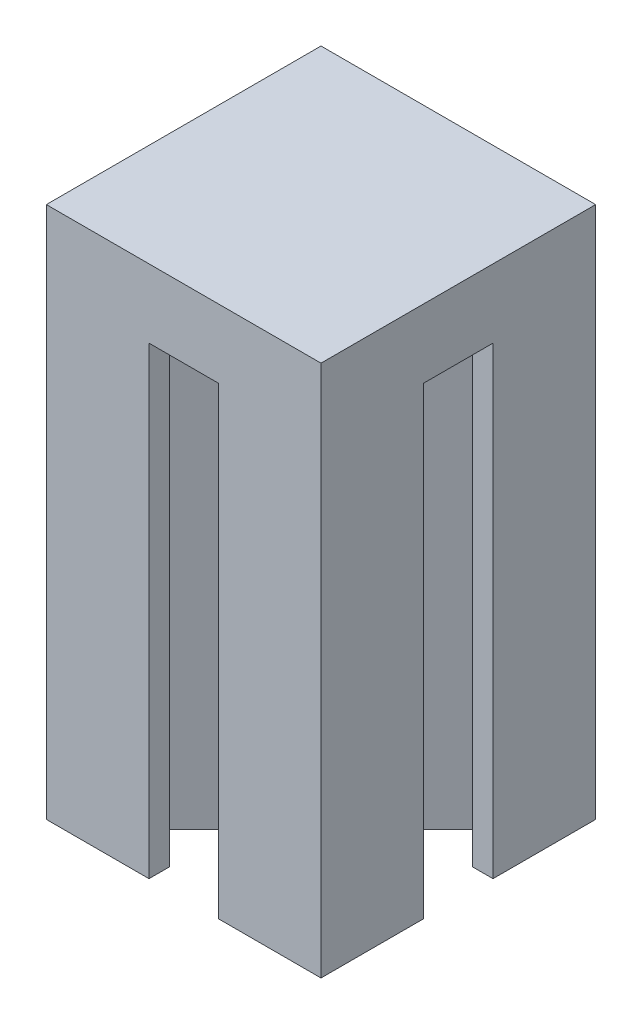
from build123d import *

# Parameters (mm, degrees)
BOSS_EXTRUDE1_DEPTH = 67.55
SKETCH2_W           = 40
SKETCH2_H           = 40
BOSS_EXTRUDE2_DEPTH = 10


with BuildPart() as part:
    # Sketch1 → Boss-Extrude1 (new body)
    with BuildSketch(Plane(origin=(0, 75.994571645, 0), x_dir=(1, 0, 0), z_dir=(0, 1, 0))):
        with BuildLine():
            Line((-75.17747299, -15.039868045), (-60.22747299, -15.039868045))
            Line((-60.22747299, -15.039868045), (-60.22747299, -12.039868045))
            Line((-60.22747299, -12.039868045), (-65.17747299, -12.039868045))
            Line((-65.17747299, -12.039868045), (-65.17747299, -12.539868045))
            Line((-65.17747299, -12.539868045), (-67.763259428, -12.539868045))
            ThreePointArc((-67.763259428, -12.539868045), (-68.68713896, -11.922551477), (-68.470366209, -10.832761264))
            Line((-68.470366209, -10.832761264), (-60.67747299, -3.039868045))
            Line((-60.67747299, -3.039868045), (-49.67747299, -3.039868045))
            Line((-49.67747299, -3.039868045), (-41.884579771, -10.832761264))
            ThreePointArc((-41.884579771, -10.832761264), (-41.66780702, -11.922551477), (-42.591686553, -12.539868045))
            Line((-42.591686553, -12.539868045), (-45.17747299, -12.539868045))
            Line((-45.17747299, -12.539868045), (-45.17747299, -12.039868045))
            Line((-45.17747299, -12.039868045), (-50.12747299, -12.039868045))
            Line((-50.12747299, -12.039868045), (-50.12747299, -15.039868045))
            Line((-50.12747299, -15.039868045), (-35.17747299, -15.039868045))
            Line((-35.17747299, -15.039868045), (-35.17747299, -0.089868045))
            Line((-35.17747299, -0.089868045), (-38.17747299, -0.089868045))
            Line((-38.17747299, -0.089868045), (-38.17747299, -5.039868045))
            Line((-38.17747299, -5.039868045), (-37.67747299, -5.039868045))
            Line((-37.67747299, -5.039868045), (-37.67747299, -7.625654482))
            ThreePointArc((-37.67747299, -7.625654482), (-38.294789558, -8.549534015), (-39.384579771, -8.332761264))
            Line((-39.384579771, -8.332761264), (-47.17747299, -0.539868045))
            Line((-47.17747299, -0.539868045), (-47.17747299, 10.460131955))
            Line((-47.17747299, 10.460131955), (-39.384579771, 18.253025174))
            ThreePointArc((-39.384579771, 18.253025174), (-38.294789558, 18.469797925), (-37.67747299, 17.545918393))
            Line((-37.67747299, 17.545918393), (-37.67747299, 14.960131955))
            Line((-37.67747299, 14.960131955), (-38.17747299, 14.960131955))
            Line((-38.17747299, 14.960131955), (-38.17747299, 10.010131955))
            Line((-38.17747299, 10.010131955), (-35.17747299, 10.010131955))
            Line((-35.17747299, 10.010131955), (-35.17747299, 24.960131955))
            Line((-35.17747299, 24.960131955), (-50.12747299, 24.960131955))
            Line((-50.12747299, 24.960131955), (-50.12747299, 21.960131955))
            Line((-50.12747299, 21.960131955), (-45.17747299, 21.960131955))
            Line((-45.17747299, 21.960131955), (-45.17747299, 22.460131955))
            Line((-45.17747299, 22.460131955), (-42.591686553, 22.460131955))
            ThreePointArc((-42.591686553, 22.460131955), (-41.66780702, 21.842815388), (-41.884579771, 20.753025174))
            Line((-41.884579771, 20.753025174), (-49.67747299, 12.960131955))
            Line((-49.67747299, 12.960131955), (-60.67747299, 12.960131955))
            Line((-60.67747299, 12.960131955), (-68.470366209, 20.753025174))
            ThreePointArc((-68.470366209, 20.753025174), (-68.68713896, 21.842815388), (-67.763259428, 22.460131955))
            Line((-67.763259428, 22.460131955), (-65.17747299, 22.460131955))
            Line((-65.17747299, 22.460131955), (-65.17747299, 21.960131955))
            Line((-65.17747299, 21.960131955), (-60.22747299, 21.960131955))
            Line((-60.22747299, 21.960131955), (-60.22747299, 24.960131955))
            Line((-60.22747299, 24.960131955), (-75.17747299, 24.960131955))
            Line((-75.17747299, 24.960131955), (-75.17747299, 10.010131955))
            Line((-75.17747299, 10.010131955), (-72.17747299, 10.010131955))
            Line((-72.17747299, 10.010131955), (-72.17747299, 14.960131955))
            Line((-72.17747299, 14.960131955), (-72.67747299, 14.960131955))
            Line((-72.67747299, 14.960131955), (-72.67747299, 17.545918393))
            ThreePointArc((-72.67747299, 17.545918393), (-72.060156423, 18.469797925), (-70.970366209, 18.253025174))
            Line((-70.970366209, 18.253025174), (-63.17747299, 10.460131955))
            Line((-63.17747299, 10.460131955), (-63.17747299, -0.539868045))
            Line((-63.17747299, -0.539868045), (-70.970366209, -8.332761264))
            ThreePointArc((-70.970366209, -8.332761264), (-72.060156423, -8.549534015), (-72.67747299, -7.625654482))
            Line((-72.67747299, -7.625654482), (-72.67747299, -5.039868045))
            Line((-72.67747299, -5.039868045), (-72.17747299, -5.039868045))
            Line((-72.17747299, -5.039868045), (-72.17747299, -0.089868045))
            Line((-72.17747299, -0.089868045), (-75.17747299, -0.089868045))
            Line((-75.17747299, -0.089868045), (-75.17747299, -15.039868045))
        make_face()
    extrude(amount=-BOSS_EXTRUDE1_DEPTH)

    # Sketch2 → Boss-Extrude2 (add)
    with BuildSketch(Plane(origin=(0, 75.994571645, 0), x_dir=(1, 0, 0), z_dir=(0, 1, 0))):
        with Locations((-55.17747299, 4.960131955)):
            Rectangle(SKETCH2_W, SKETCH2_H)
    extrude(amount=BOSS_EXTRUDE2_DEPTH)


solid = part.part
